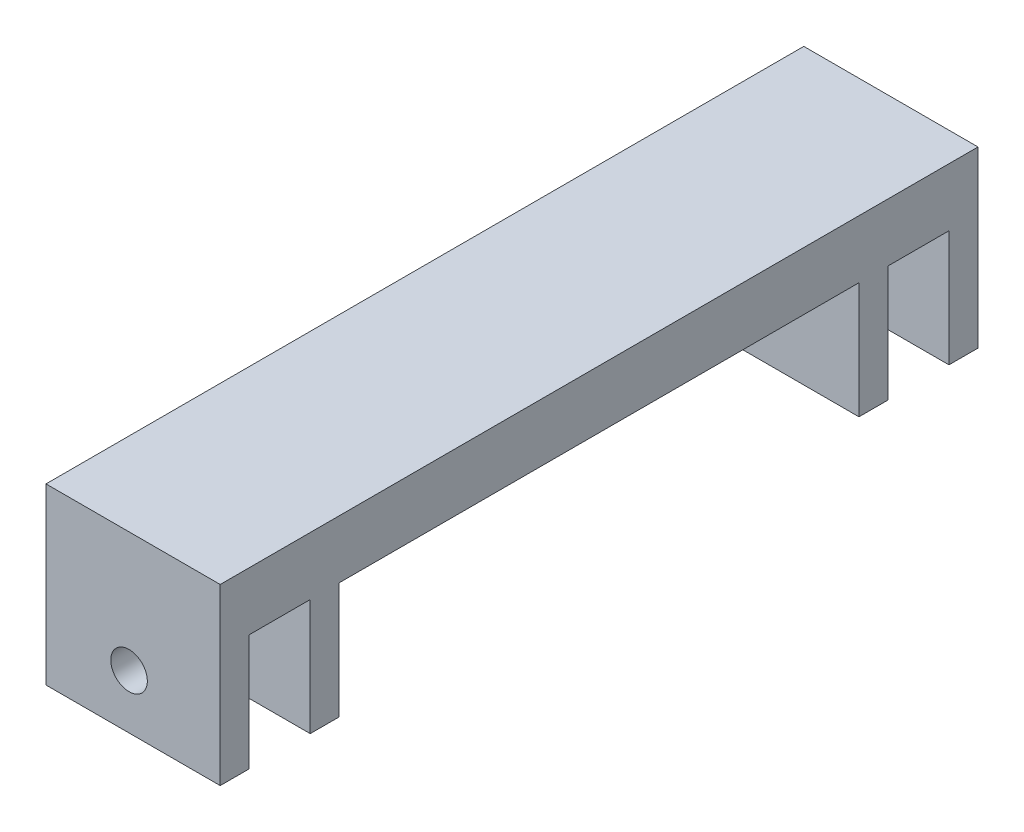
from build123d import *

# Parameters (mm, degrees)
ESQUISSE1_W             = 30
ESQUISSE1_H             = 10
BOSS_EXTRU_1_DEPTH      = 130.5
ESQUISSE2_W             = 30
ESQUISSE2_H             = 5
BOSS_EXTRU_2_DEPTH      = 20
ESQUISSE3_R             = 3.15
ENL_V_MAT_EXTRU_2_DEPTH = 136.389253636


with BuildPart() as part:
    # Esquisse1 → Boss.-Extru.1 (new body)
    with BuildSketch(Plane.XY):
        with Locations((15, 5)):
            Rectangle(ESQUISSE1_W, ESQUISSE1_H)
    extrude(amount=BOSS_EXTRU_1_DEPTH)

    # Esquisse2 → Boss.-Extru.2 (add)
    with BuildSketch(Plane.XZ):
        with Locations((15, 2.5)):
            Rectangle(ESQUISSE2_W, ESQUISSE2_H)
        with Locations((15, 18)):
            Rectangle(ESQUISSE2_W, ESQUISSE2_H)
        with Locations((15, 128)):
            Rectangle(ESQUISSE2_W, ESQUISSE2_H)
        with Locations((15, 112.5)):
            Rectangle(ESQUISSE2_W, ESQUISSE2_H)
    extrude(amount=BOSS_EXTRU_2_DEPTH)

    # Esquisse3 → Enlèv. mat.-Extru.2 (cut, through all)
    with BuildSketch(Plane.XY.offset(130.5)):
        with Locations((14.302143115, -10.686909811)):
            Circle(ESQUISSE3_R)
    extrude(amount=-ENL_V_MAT_EXTRU_2_DEPTH, mode=Mode.SUBTRACT)


solid = part.part
